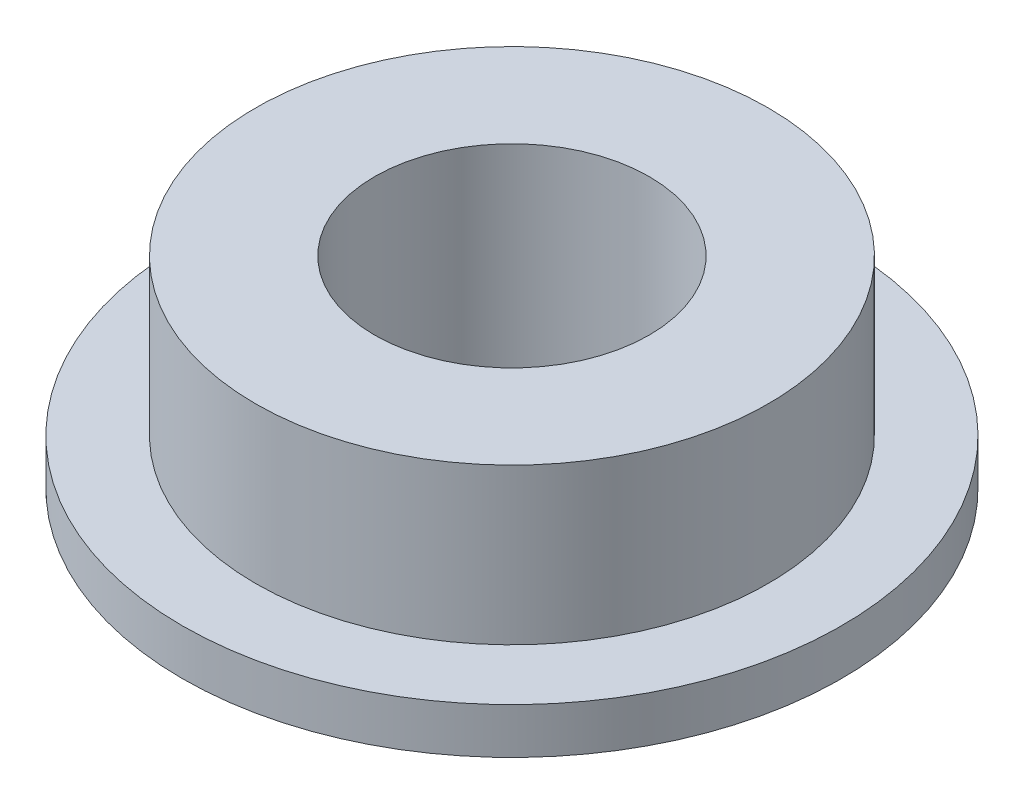
from build123d import *

# Parameters (mm, degrees)
SKETCH_1_R      = 18
SKETCH_1_R_2    = 7.5
EXTRUDE_1_DEPTH = 2.5
SKETCH_2_R      = 14
SKETCH_2_R_2    = 7.5
EXTRUDE_2_DEPTH = 8.5


with BuildPart() as part:
    # 草圖1 → 填料-伸長1 (new body)
    with BuildSketch(Plane(origin=(0, 0, 0), x_dir=(1, 0, 0), z_dir=(0, 1, 0))):
        with Locations(Location((0, 0, 0), (0, 0, 270))):
            Circle(SKETCH_1_R)
        with Locations(Location((0, 0, 0), (0, 0, 270))):
            Circle(SKETCH_1_R_2, mode=Mode.SUBTRACT)
    extrude(amount=EXTRUDE_1_DEPTH)

    # 草圖2 → 填料-伸長2 (add)
    with BuildSketch(Plane(origin=(0, 2.5, 0), x_dir=(1, 0, 0), z_dir=(0, 1, 0))):
        with Locations(Location((0, 0, 0), (0, 0, 270))):
            Circle(SKETCH_2_R)
        with Locations(Location((0, 0, 0), (0, 0, 270))):
            Circle(SKETCH_2_R_2, mode=Mode.SUBTRACT)
    extrude(amount=EXTRUDE_2_DEPTH)


solid = part.part
